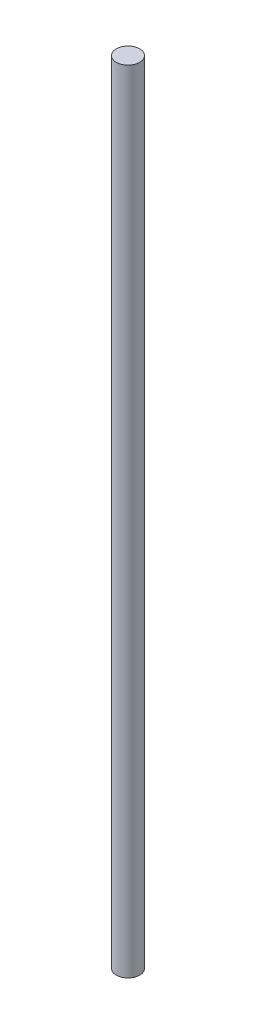
from build123d import *

# Parameters (mm, degrees)
SKETCH_4_R      = 0.5
EXTRUDE_1_DEPTH = 33.8


with BuildPart() as part:
    # 草图4 → 凸台-拉伸1 (new body)
    with BuildSketch(Plane(origin=(0, 0, 0), x_dir=(1, 0, 0), z_dir=(0, 1, 0))):
        with Locations(Location((0, 0, 0), (0, 0, 270))):
            Circle(SKETCH_4_R)
    extrude(amount=EXTRUDE_1_DEPTH)


solid = part.part
